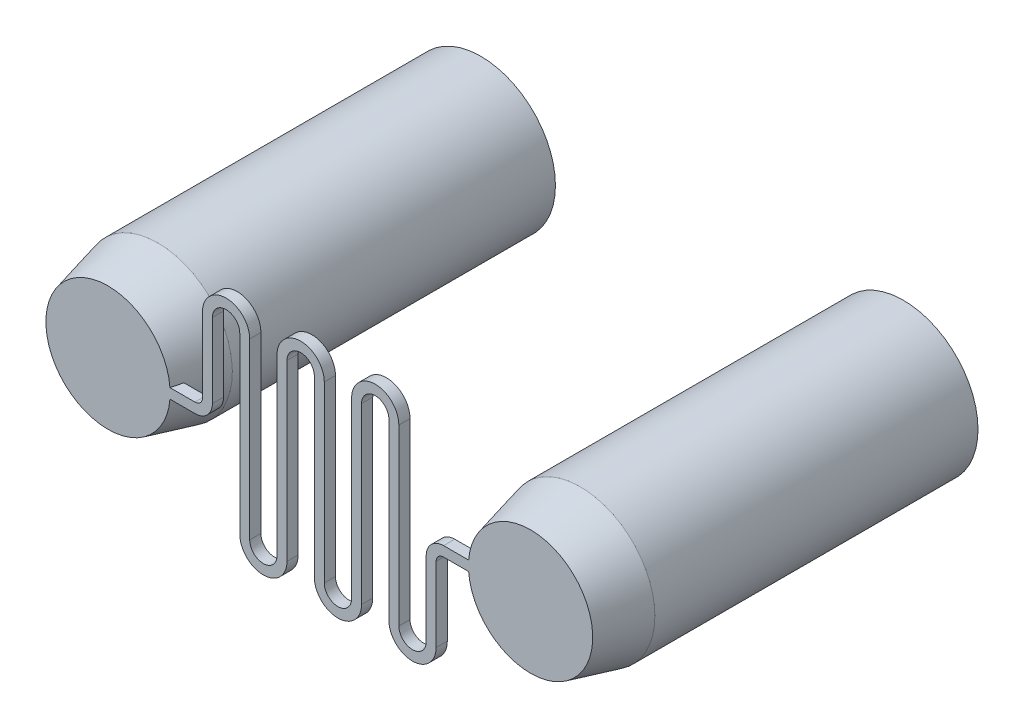
from build123d import *

# Parameters (mm, degrees)
BOSS_EXTRUDE1_DEPTH = 0.9


with BuildPart() as part:
    # Sketch2 → Boss-Extrude1 (new body)
    with BuildSketch(Plane.XY):
        with BuildLine():
            Line((-20.5, -0.4), (-13.5, -0.4))
            ThreePointArc((-13.5, -0.4), (-12.510050506, 0.010050506), (-12.1, 1))
            Line((-12.1, 1), (-12.1, 7))
            ThreePointArc((-12.1, 7), (-11, 8.1), (-9.9, 7))
            Line((-9.9, 7), (-9.9, 0))
            Line((-9.9, 0), (-9.9, -7))
            ThreePointArc((-9.9, -7), (-8, -8.9), (-6.1, -7))
            Line((-6.1, -7), (-6.1, 0))
            Line((-6.1, 0), (-6.1, 7))
            ThreePointArc((-6.1, 7), (-5, 8.1), (-3.9, 7))
            Line((-3.9, 7), (-3.9, 0))
            Line((-3.9, 0), (-3.9, -7))
            ThreePointArc((-3.9, -7), (-2, -8.9), (-0.1, -7))
            Line((-0.1, -7), (-0.1, 0))
            Line((-0.1, 0), (-0.1, 7))
            ThreePointArc((-0.1, 7), (1, 8.1), (2.1, 7))
            Line((2.1, 7), (2.1, 0))
            Line((2.1, 0), (2.1, -7))
            ThreePointArc((2.1, -7), (4, -8.9), (5.9, -7))
            Line((5.9, -7), (5.9, -1))
            ThreePointArc((5.9, -1), (6.075735931, -0.575735931), (6.5, -0.4))
            Line((6.5, -0.4), (13.5, -0.4))
            ThreePointArc((13.5, -0.4), (13.9, 0), (13.5, 0.4))
            Line((13.5, 0.4), (6.5, 0.4))
            ThreePointArc((6.5, 0.4), (5.510050506, -0.010050506), (5.1, -1))
            Line((5.1, -1), (5.1, -7))
            ThreePointArc((5.1, -7), (4, -8.1), (2.9, -7))
            Line((2.9, -7), (2.9, 0))
            Line((2.9, 0), (2.9, 7))
            ThreePointArc((2.9, 7), (1, 8.9), (-0.9, 7))
            Line((-0.9, 7), (-0.9, 0))
            Line((-0.9, 0), (-0.9, -7))
            ThreePointArc((-0.9, -7), (-2, -8.1), (-3.1, -7))
            Line((-3.1, -7), (-3.1, 0))
            Line((-3.1, 0), (-3.1, 7))
            ThreePointArc((-3.1, 7), (-5, 8.9), (-6.9, 7))
            Line((-6.9, 7), (-6.9, 0))
            Line((-6.9, 0), (-6.9, -7))
            ThreePointArc((-6.9, -7), (-8, -8.1), (-9.1, -7))
            Line((-9.1, -7), (-9.1, 0))
            Line((-9.1, 0), (-9.1, 7))
            ThreePointArc((-9.1, 7), (-11, 8.9), (-12.9, 7))
            Line((-12.9, 7), (-12.9, 1))
            ThreePointArc((-12.9, 1), (-13.075735931, 0.575735931), (-13.5, 0.4))
            Line((-13.5, 0.4), (-20.5, 0.4))
            ThreePointArc((-20.5, 0.4), (-20.9, 0), (-20.5, -0.4))
        make_face()
    extrude(amount=BOSS_EXTRUDE1_DEPTH)

    # Sketch3 → Revolve1 (revolve)
    with BuildSketch(Plane(origin=(0, 0, 0), x_dir=(1, 0, 0), z_dir=(0, 1, 0)), mode=Mode.PRIVATE) as revolve1_sk:
        Polygon((-20.5, -0.9), (-25.5, -0.9), (-26.5, 3.1), (-26.5, 29.1), (-20.5, 29.1), align=None)
    revolve(revolve1_sk.sketch.rotate(Axis((-20.5, 0, 0.9), (0, 0, -1)), 175.411434264), axis=Axis((-20.5, 0, 0.9), (0, 0, -1)))

    # Sketch4 → Revolve2 (revolve)
    with BuildSketch(Plane(origin=(0, 0, 0), x_dir=(1, 0, 0), z_dir=(0, 1, 0)), mode=Mode.PRIVATE) as revolve2_sk:
        Polygon((13.5, -0.9), (18.5, -0.9), (19.5, 3.1), (19.5, 29.1), (13.5, 29.1), align=None)
    revolve(revolve2_sk.sketch.rotate(Axis((13.5, 0, 0.9), (0, 0, -1)), 175.609427397), axis=Axis((13.5, 0, 0.9), (0, 0, -1)))


solid = part.part
